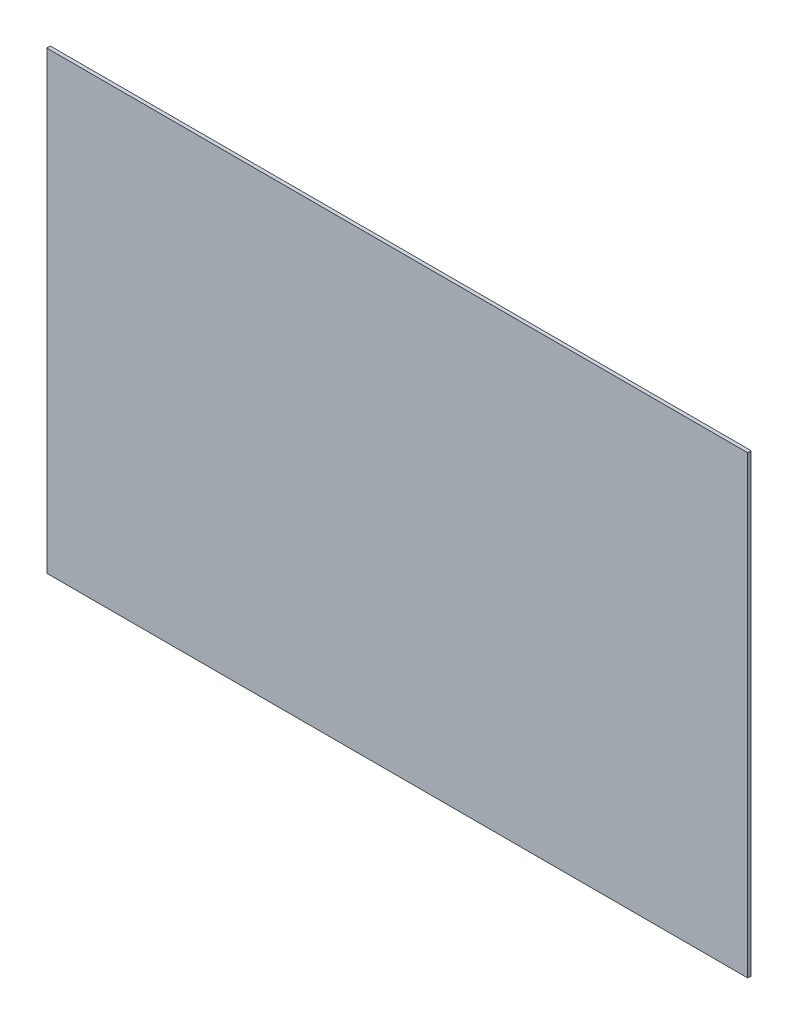
from build123d import *

# Parameters (mm, degrees)
SKETCH1_W           = 299.7
SKETCH1_H           = 194.5
BOSS_EXTRUDE1_DEPTH = 1.5


with BuildPart() as part:
    # Sketch1 → Boss-Extrude1 (new body)
    with BuildSketch(Plane.XY):
        Rectangle(SKETCH1_W, SKETCH1_H)
    extrude(amount=BOSS_EXTRUDE1_DEPTH)


solid = part.part
